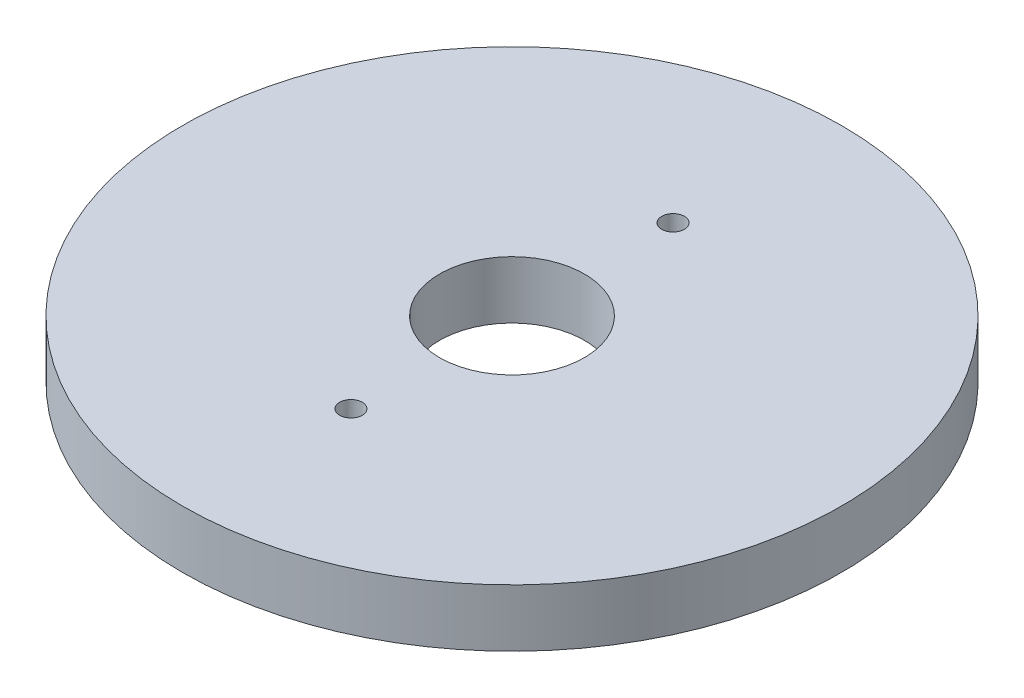
from build123d import *

# Parameters (mm, degrees)
SKETCH1_R                       = 36.3855
BOSS_EXTRUDE1_DEPTH             = 6.35
TAP_DRILL_FOR_M3X0_5_TAP2_D     = 2.5
TAP_DRILL_FOR_M3X0_5_TAP2_DEPTH = 3.175
TAP_DRILL_FOR_M3X0_5_TAP2_TIP   = 0.751075774
SKETCH7_R                       = 8.001
CUT_EXTRUDE1_DEPTH              = 52.847195879


with BuildPart() as part:
    # Sketch1 → Boss-Extrude1 (new body)
    with BuildSketch(Plane(origin=(0, 0, 0), x_dir=(1, 0, 0), z_dir=(0, 1, 0))):
        with Locations(Location((0, 0, 0), (0, 0, 270))):
            Circle(SKETCH1_R)
    extrude(amount=BOSS_EXTRUDE1_DEPTH)

    # Tap Drill for M3x0.5 Tap2
    with Locations(Plane(origin=(0, 6.35, 0), x_dir=(1, 0, 0), z_dir=(0, 1, 0))):
        with Locations((0, 17.78), (0, -17.78)):
            Hole(TAP_DRILL_FOR_M3X0_5_TAP2_D / 2, depth=TAP_DRILL_FOR_M3X0_5_TAP2_DEPTH)
            with Locations((0, 0, -(TAP_DRILL_FOR_M3X0_5_TAP2_DEPTH + TAP_DRILL_FOR_M3X0_5_TAP2_TIP / 2))):  # 118° drill point
                Cone(0, TAP_DRILL_FOR_M3X0_5_TAP2_D / 2, TAP_DRILL_FOR_M3X0_5_TAP2_TIP, mode=Mode.SUBTRACT)

    # Sketch7 → Cut-Extrude1 (cut, through all)
    with BuildSketch(Plane(origin=(0, 6.35, 0), x_dir=(1, 0, 0), z_dir=(0, 1, 0))):
        with Locations(Location((0, 0, 0), (0, 0, 270))):
            Circle(SKETCH7_R)
    extrude(amount=-CUT_EXTRUDE1_DEPTH, mode=Mode.SUBTRACT)


solid = part.part
